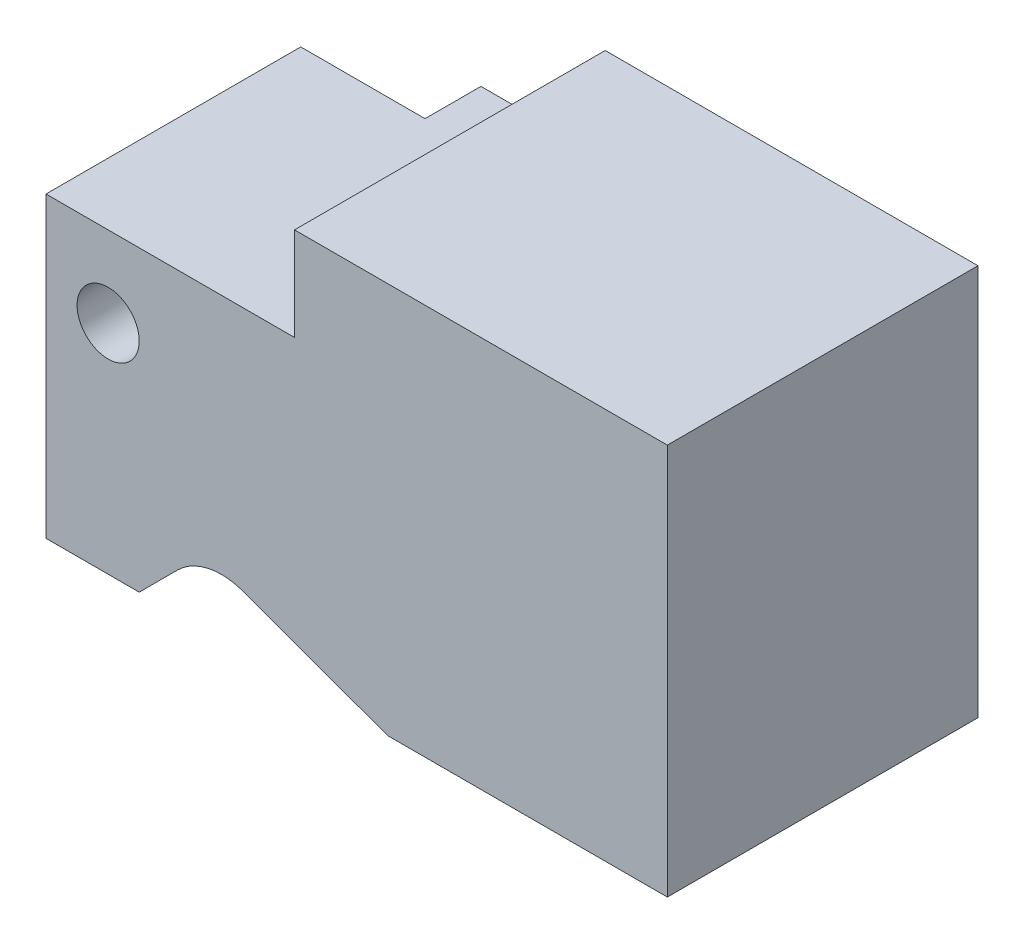
from build123d import *

# Parameters (mm, degrees)
SKETCH_1_W          = 100
SKETCH_1_H          = 63
EXTRUDE_1_DEPTH     = 50
SKETCH_2_W          = 40
SKETCH_2_H          = 15
CUT_EXTRUDE_2_DEPTH = 129.33160172
CUT_EXTRUDE_3_DEPTH = 9
SKETCH_3_3_R        = 5
CUT_EXTRUDE_4_DEPTH = 129.33160172
CUT_EXTRUDE_5_DEPTH = 129.33160172
SKETCH_7_R          = 25
CUT_EXTRUDE_6_DEPTH = 13
EXTRUDE_2_DEPTH     = 5
EXTRUDE_3_DEPTH     = 8


with BuildPart() as part:
    # 草圖1 → 填料-伸長1 (new body)
    with BuildSketch(Plane.XY):
        with Locations((50, 31.5)):
            Rectangle(SKETCH_1_W, SKETCH_1_H)
    extrude(amount=EXTRUDE_1_DEPTH)

    # 草圖2 → 除料-伸長2 (cut, through all)
    with BuildSketch(Plane(origin=(0, 0, 0), x_dir=(-1, 0, 0), z_dir=(0, 0, -1))):
        with Locations((-20, 55.5)):
            Rectangle(SKETCH_2_W, SKETCH_2_H)
    extrude(amount=-CUT_EXTRUDE_2_DEPTH, mode=Mode.SUBTRACT)

    # 草圖3 → 除料-伸長3 (cut)
    with BuildSketch(Plane(origin=(0, 0, 0), x_dir=(-1, 0, 0), z_dir=(0, 0, -1))):
        with BuildLine():
            Line((-20, 48), (-20, 35))
            ThreePointArc((-20, 35), (-14.142135624, 20.857864376), (0, 15))
            Line((0, 15), (0, 48))
            Line((0, 48), (-20, 48))
        make_face()
    extrude(amount=-CUT_EXTRUDE_3_DEPTH, mode=Mode.SUBTRACT)

    # 草圖3<3> → 除料-伸長4 (cut, through all)
    with BuildSketch(Plane(origin=(0, 0, 0), x_dir=(-1, 0, 0), z_dir=(0, 0, -1))):
        with Locations((-10, 35)):
            Circle(SKETCH_3_3_R)
    extrude(amount=-CUT_EXTRUDE_4_DEPTH, mode=Mode.SUBTRACT)

    # 草圖6 → 除料-伸長5 (cut, through all)
    with BuildSketch(Plane(origin=(0, 0, 0), x_dir=(-1, 0, 0), z_dir=(0, 0, -1))):
        with BuildLine():
            Line((-15, 0), (-21.169079822, 6.169079822))
            ThreePointArc((-21.169079822, 6.169079822), (-26.075751494, 8.860972081), (-31.660349067, 8.494938218))
            Line((-31.660349067, 8.494938218), (-55, 0))
            Line((-55, 0), (-15, 0))
        make_face()
    extrude(amount=-CUT_EXTRUDE_5_DEPTH, mode=Mode.SUBTRACT)

    # 草圖7 → 除料-伸長6 (cut)
    with BuildSketch(Plane(origin=(0, 0, 0), x_dir=(-1, 0, 0), z_dir=(0, 0, -1))):
        with Locations((-70, 35)):
            Circle(SKETCH_7_R)
    extrude(amount=-CUT_EXTRUDE_6_DEPTH, mode=Mode.SUBTRACT)


with BuildPart() as body_2:
    # 草圖7<3> → 填料-伸長2 (new body)
    with BuildSketch(Plane(origin=(0, 0, 0), x_dir=(-1, 0, 0), z_dir=(0, 0, -1))):
        with BuildLine():
            ThreePointArc((-70, 25), (-60, 35), (-70, 45))
            Line((-70, 45), (-70, 40))
            ThreePointArc((-70, 40), (-66.464466094, 38.535533906), (-65, 35))
            ThreePointArc((-65, 35), (-66.464466094, 31.464466094), (-70, 30))
            Line((-70, 30), (-70, 25))
        make_face()
    extrude(amount=EXTRUDE_2_DEPTH)

    # 草圖7<4> → 填料-伸長3 (add)
    with BuildSketch(Plane(origin=(0, 0, 0), x_dir=(-1, 0, 0), z_dir=(0, 0, -1))):
        with BuildLine():
            ThreePointArc((-65, 35), (-66.464466094, 38.535533906), (-70, 40))
            ThreePointArc((-70, 40), (-75, 35), (-70, 30))
            ThreePointArc((-70, 30), (-66.464466094, 31.464466094), (-65, 35))
        make_face()
    extrude(amount=EXTRUDE_3_DEPTH)


solid = Compound([part.part, body_2.part])
